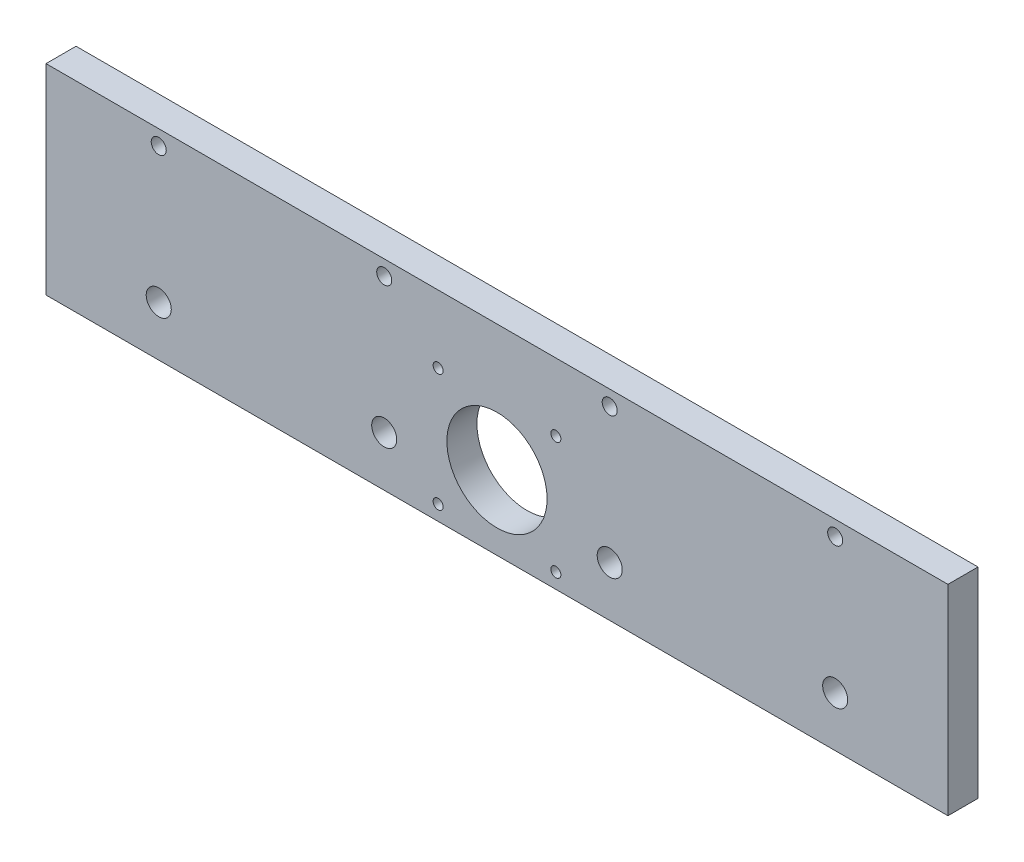
from build123d import *

# Parameters (mm, degrees)
SKETCH1_W           = 360
SKETCH1_H           = 80
BOSS_EXTRUDE1_DEPTH = 12
CUT_EXTRUDE1_REACH  = 186.781
SKETCH2_R           = 3
SKETCH2_R_2         = 5
LPATTERN1_COUNT     = 4
LPATTERN1_PITCH     = 90
CUT_EXTRUDE2_REACH  = 186.781
SKETCH3_R           = 20
CUT_EXTRUDE3_REACH  = 186.781
SKETCH4_R           = 2


with BuildPart() as part:
    # Sketch1 → Boss-Extrude1 (new body)
    with BuildSketch(Plane.XY):
        Rectangle(SKETCH1_W, SKETCH1_H)
    extrude(amount=BOSS_EXTRUDE1_DEPTH)

    # Sketch2 → Cut-Extrude1 (cut, up to next)
    with BuildSketch(Plane.XY.offset(12), mode=Mode.PRIVATE) as cut_extrude1_sk1:
        with Locations((135, 34)):
            Circle(SKETCH2_R)
    cut_extrude1_tool1 = extrude(cut_extrude1_sk1.sketch, amount=-CUT_EXTRUDE1_REACH, mode=Mode.PRIVATE) & part.part
    # Sketch2 → Cut-Extrude1 (cut, up to next)
    with BuildSketch(Plane.XY.offset(12), mode=Mode.PRIVATE) as cut_extrude1_sk2:
        with Locations((135, -20)):
            Circle(SKETCH2_R_2)
    cut_extrude1_tool2 = extrude(cut_extrude1_sk2.sketch, amount=-CUT_EXTRUDE1_REACH, mode=Mode.PRIVATE) & part.part
    cut_extrude1_1 = cut_extrude1_tool1.solids().sort_by_distance((135, 34, 12))[0]
    add(cut_extrude1_1, mode=Mode.SUBTRACT)
    cut_extrude1_2 = cut_extrude1_tool2.solids().sort_by_distance((135, -20, 12))[0]
    add(cut_extrude1_2, mode=Mode.SUBTRACT)
    cut_extrude1 = cut_extrude1_1 + cut_extrude1_2  # Cut-Extrude1 as one shape, for the pattern or mirror that repeats it

    # LPattern1: Cut-Extrude1 ×4
    with Locations(*[(-i * LPATTERN1_PITCH, 0, 0) for i in range(1, LPATTERN1_COUNT)]):
        add(cut_extrude1, mode=Mode.SUBTRACT)

    # Sketch3 → Cut-Extrude2 (cut, up to next)
    with BuildSketch(Plane.XY.offset(12), mode=Mode.PRIVATE) as cut_extrude2_sk1:
        with Locations((0, -10.5)):
            Circle(SKETCH3_R)
    cut_extrude2_tool1 = extrude(cut_extrude2_sk1.sketch, amount=-CUT_EXTRUDE2_REACH, mode=Mode.PRIVATE) & part.part
    add(cut_extrude2_tool1.solids().sort_by_distance((0, -10.5, 12))[0], mode=Mode.SUBTRACT)

    # Sketch4 → Cut-Extrude3 (cut, up to next)
    with BuildSketch(Plane.XY.offset(12), mode=Mode.PRIVATE) as cut_extrude3_sk1:
        with Locations((-23.5, 13)):
            Circle(SKETCH4_R)
    cut_extrude3_tool1 = extrude(cut_extrude3_sk1.sketch, amount=-CUT_EXTRUDE3_REACH, mode=Mode.PRIVATE) & part.part
    # Sketch4 → Cut-Extrude3 (cut, up to next)
    with BuildSketch(Plane.XY.offset(12), mode=Mode.PRIVATE) as cut_extrude3_sk2:
        with Locations((-23.5, -34)):
            Circle(SKETCH4_R)
    cut_extrude3_tool2 = extrude(cut_extrude3_sk2.sketch, amount=-CUT_EXTRUDE3_REACH, mode=Mode.PRIVATE) & part.part
    cut_extrude3_1 = cut_extrude3_tool1.solids().sort_by_distance((-23.5, 13, 12))[0]
    add(cut_extrude3_1, mode=Mode.SUBTRACT)
    cut_extrude3_2 = cut_extrude3_tool2.solids().sort_by_distance((-23.5, -34, 12))[0]
    add(cut_extrude3_2, mode=Mode.SUBTRACT)
    cut_extrude3 = cut_extrude3_1 + cut_extrude3_2  # Cut-Extrude3 as one shape, for the pattern or mirror that repeats it

    # Mirror2: Cut-Extrude3 across plane
    add(cut_extrude3.mirror(Plane(origin=(0, 0, 0), x_dir=(0, 0, 1), z_dir=(1, 0, 0))), mode=Mode.SUBTRACT)


solid = part.part
